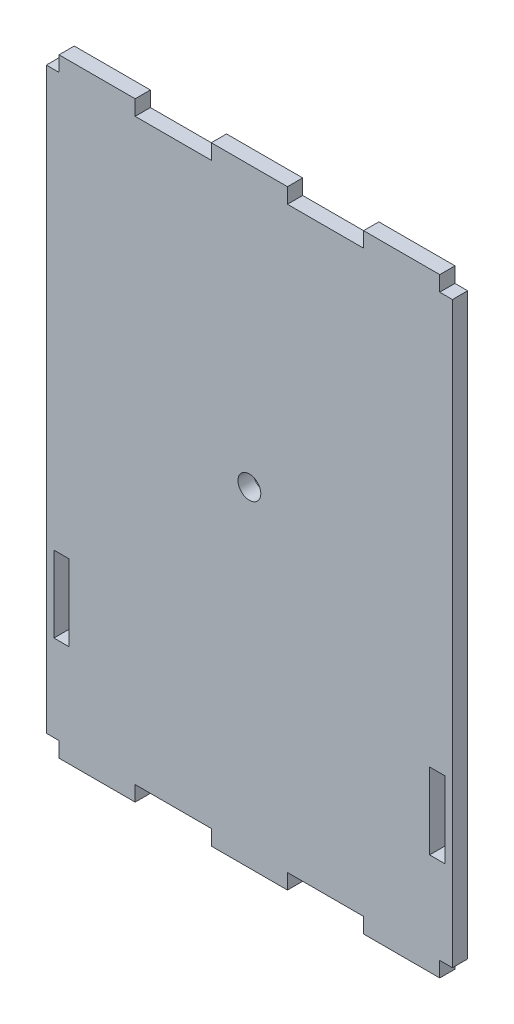
from build123d import *

# Parameters (mm, degrees)
SKETCH_1_W          = 3
SKETCH_1_H          = 15
EXTRUDE_1_DEPTH     = 3
SKETCH_2_R          = 2.25
CUT_EXTRUDE_1_DEPTH = 10


with BuildPart() as part:
    # 草图1 → 凸台-拉伸1 (new body)
    with BuildSketch(Plane.XY):
        Polygon((2.5, 3), (0, 3), (0, 117), (2.5, 117), (2.5, 120), (17.5, 120), (17.5, 117), (32.5, 117), (32.5, 120), (47.5, 120), (47.5, 117), (62.5, 117), (62.5, 120), (77.5, 120), (77.5, 117), (80, 117), (80, 3), (77.5, 3), (77.5, 0), (62.5, 0), (62.5, 3), (47.5, 3), (47.5, 0), (32.5, 0), (32.5, 3), (17.5, 3), (17.5, 0), (2.5, 0), align=None)
        with Locations((77, 27.5)):
            Rectangle(SKETCH_1_W, SKETCH_1_H, mode=Mode.SUBTRACT)
        with Locations((3, 27.5)):
            Rectangle(SKETCH_1_W, SKETCH_1_H, mode=Mode.SUBTRACT)
    extrude(amount=EXTRUDE_1_DEPTH)

    # 草图2 → 切除-拉伸1 (cut)
    with BuildSketch(Plane.XY.offset(3)):
        with Locations((40, 65)):
            Circle(SKETCH_2_R)
    extrude(amount=-CUT_EXTRUDE_1_DEPTH, mode=Mode.SUBTRACT)


solid = part.part
